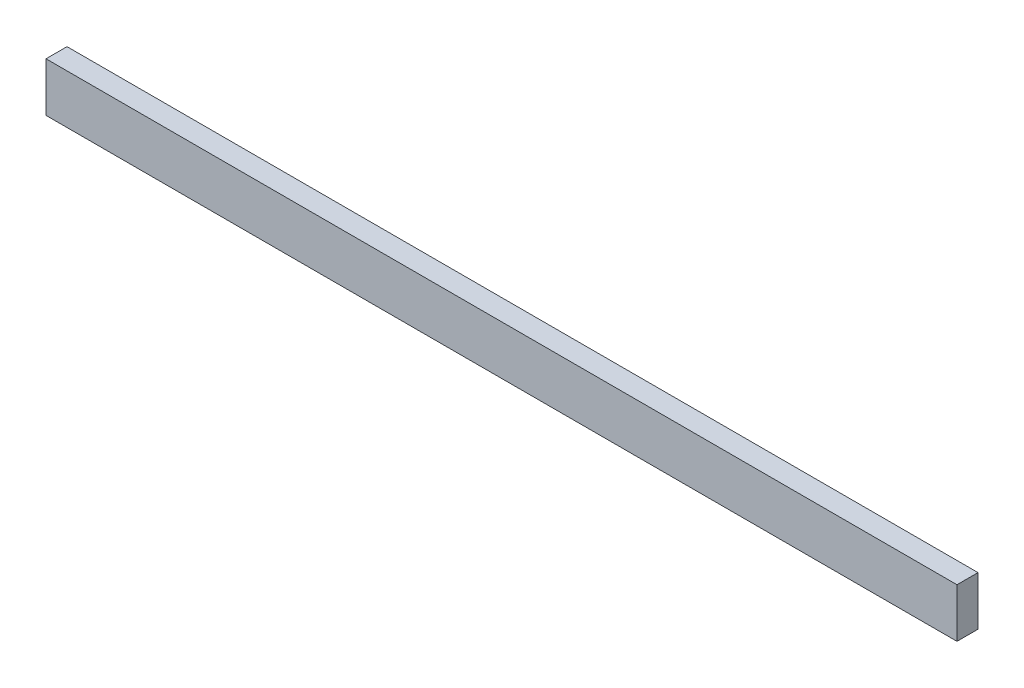
from build123d import *

# Parameters (mm, degrees)
SKETCH_1_W         = 650
SKETCH_1_H         = 35
BLOCKEXTRUDE_DEPTH = 15


with BuildPart() as part:
    # 草图1 → BlockExtrude (new body)
    with BuildSketch(Plane.XY):
        with Locations((325, 17.5)):
            Rectangle(SKETCH_1_W, SKETCH_1_H)
    extrude(amount=BLOCKEXTRUDE_DEPTH)


solid = part.part
